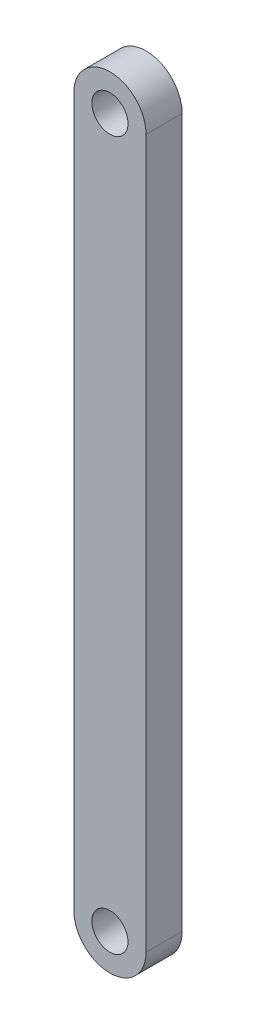
from build123d import *

# Parameters (mm, degrees)
CROQUIS1_R              = 3
SALIENTE_EXTRUIR1_DEPTH = 6


with BuildPart() as part:
    # Croquis1 → Saliente-Extruir1 (new body)
    with BuildSketch(Plane.XY):
        with BuildLine():
            Line((-6, 0), (-6, 117.69))
            ThreePointArc((-6, 117.69), (0, 123.69), (6, 117.69))
            Line((6, 117.69), (6, 0))
            ThreePointArc((6, 0), (0, -6), (-6, 0))
        make_face()
        Circle(CROQUIS1_R, mode=Mode.SUBTRACT)
        with Locations((0, 117.69)):
            Circle(CROQUIS1_R, mode=Mode.SUBTRACT)
    extrude(amount=SALIENTE_EXTRUIR1_DEPTH)


solid = part.part
